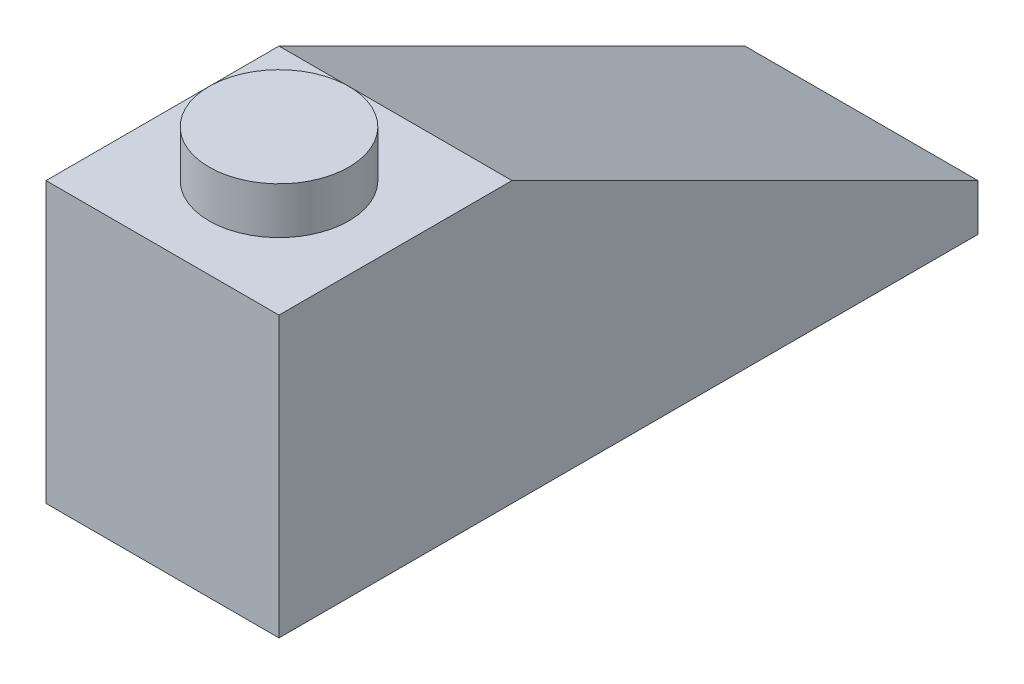
from build123d import *

# Parameters (mm, degrees)
BOSS_EXTRUDE1_DEPTH = 8
SKETCH2_R           = 2.4
BOSS_EXTRUDE2_DEPTH = 1.6
SHELL1_T            = -1.6


with BuildPart() as part:
    # Sketch1 → Boss-Extrude1 (new body)
    with BuildSketch(Plane(origin=(0, 0, 0), x_dir=(0, 0, -1), z_dir=(1, 0, 0))):
        Polygon((0, 0), (24, 0), (24, 1.6), (8, 9.6), (0, 9.6), align=None)
    extrude(amount=BOSS_EXTRUDE1_DEPTH)

    # Sketch2 → Boss-Extrude2 (add)
    with BuildSketch(Plane(origin=(0, 9.6, 0), x_dir=(1, 0, 0), z_dir=(0, 1, 0))):
        with Locations(Location((4, 4, 0), (0, 0, 270))):
            Circle(SKETCH2_R)
    extrude(amount=BOSS_EXTRUDE2_DEPTH)

    # Shell1
    shell1_openings = [part.faces().sort_by_distance(p)[0] for p in [
        (4, 0, -12),
    ]]
    offset(amount=SHELL1_T, openings=shell1_openings, kind=Kind.INTERSECTION)


solid = part.part
